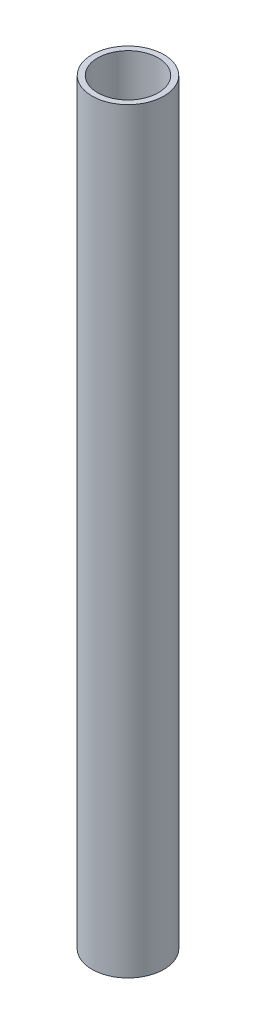
from build123d import *

# Parameters (mm, degrees)
SKETCH1_R           = 9.5
SKETCH1_R_2         = 8
BOSS_EXTRUDE1_DEPTH = 200


with BuildPart() as part:
    # Sketch1 → Boss-Extrude1 (new body)
    with BuildSketch(Plane(origin=(0, 0, 0), x_dir=(1, 0, 0), z_dir=(0, 1, 0))):
        with Locations(Location((0, 0, 0), (0, 0, 270))):
            Circle(SKETCH1_R)
        with Locations(Location((0, 0, 0), (0, 0, 270))):
            Circle(SKETCH1_R_2, mode=Mode.SUBTRACT)
    extrude(amount=BOSS_EXTRUDE1_DEPTH)


solid = part.part
